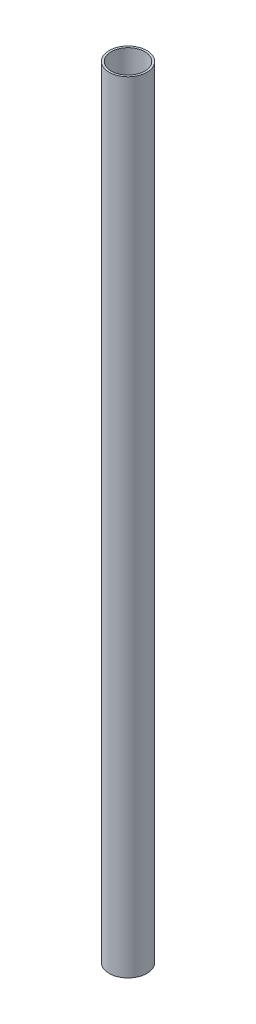
from build123d import *

# Parameters (mm, degrees)
SKETCH1_R           = 11.665
SKETCH1_R_2         = 10.395
BOSS_EXTRUDE1_DEPTH = 241.3


with BuildPart() as part:
    # Sketch1 → Boss-Extrude1 (new, symmetric)
    with BuildSketch(Plane(origin=(0, 0, 0), x_dir=(1, 0, 0), z_dir=(0, 1, 0))):
        with Locations(Location((0, 0, 0), (0, 0, 90))):
            Circle(SKETCH1_R)
        with Locations(Location((0, 0, 0), (0, 0, 90))):
            Circle(SKETCH1_R_2, mode=Mode.SUBTRACT)
    extrude(amount=BOSS_EXTRUDE1_DEPTH, both=True)


solid = part.part
